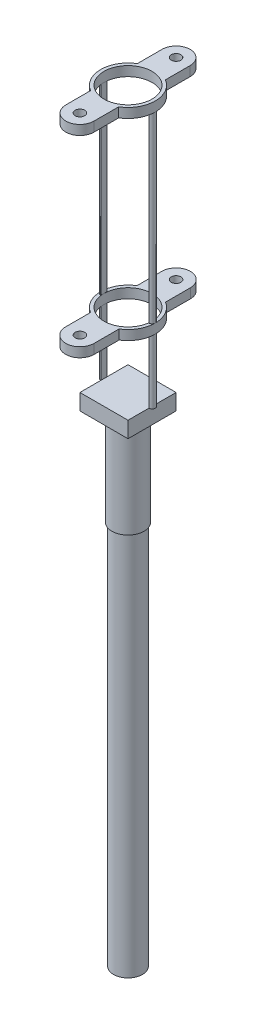
from build123d import *

# Parameters (mm, degrees)
SKETCH1_R             = 5
BOSS_EXTRUDE2_DEPTH   = 40
SKETCH2_R             = 5
SKETCH2_R_2           = 4.5
CUT_EXTRUDE1_DEPTH    = 10
SKETCH3_W             = 15
SKETCH3_H             = 15
BOSS_EXTRUDE3_DEPTH   = 5
BOSS_EXTRUDE4_DEPTH   = 80
BOSS_EXTRUDE4_2_DEPTH = 80
SKETCH5_R             = 8.5
SKETCH5_R_2           = 7.5
BOSS_EXTRUDE5_DEPTH   = 3
SKETCH6_R             = 1.5
BOSS_EXTRUDE6_DEPTH   = 3
BOSS_EXTRUDE7_START   = -110
SKETCH7_R             = 4.5
BOSS_EXTRUDE7_DEPTH   = 110
SKETCH8_R             = 7.5
BOSS_EXTRUDE8_DEPTH   = 3
SKETCH10_R            = 1.5
CUT_EXTRUDE2_DEPTH    = 3


with BuildPart() as part:
    # Sketch1 → Boss-Extrude2 (new body)
    with BuildSketch(Plane(origin=(0, 0, 0), x_dir=(1, 0, 0), z_dir=(0, 1, 0))):
        with Locations(Location((0, 0, 0), (0, 0, 270))):
            Circle(SKETCH1_R)
    extrude(amount=BOSS_EXTRUDE2_DEPTH)

    # Sketch2 → Cut-Extrude1 (cut)
    with BuildSketch(Plane(origin=(0, 0, 0), x_dir=(1, 0, 0), z_dir=(0, 1, 0))):
        with Locations(Location((0, 0, 0), (0, 0, 270))):
            Circle(SKETCH2_R)
        with Locations(Location((0, 0, 0), (0, 0, 270))):
            Circle(SKETCH2_R_2, mode=Mode.SUBTRACT)
    extrude(amount=CUT_EXTRUDE1_DEPTH, mode=Mode.SUBTRACT)

    # Sketch3 → Boss-Extrude3 (add)
    with BuildSketch(Plane(origin=(0, 40, 0), x_dir=(1, 0, 0), z_dir=(0, 1, 0))):
        Rectangle(SKETCH3_W, SKETCH3_H)
    extrude(amount=BOSS_EXTRUDE3_DEPTH)

    # Sketch7 → Boss-Extrude7 (add)
    with BuildSketch(Plane(origin=(0, 0, 0), x_dir=(1, 0, 0), z_dir=(0, 1, 0)).offset(BOSS_EXTRUDE7_START)):
        with Locations(Location((0, 0, 0), (0, 0, 270))):
            Circle(SKETCH7_R)
    extrude(amount=BOSS_EXTRUDE7_DEPTH)


with BuildPart() as body_2:
    # Sketch4 → Boss-Extrude4 (new body)
    with BuildSketch(Plane(origin=(0, 45, 0), x_dir=(1, 0, 0), z_dir=(0, 1, 0))):
        with BuildLine():
            Line((-7.5, -1), (-7.5, 1))
            ThreePointArc((-7.5, 1), (-8.5, 0), (-7.5, -1))
        make_face()
    extrude(amount=BOSS_EXTRUDE4_DEPTH)



with BuildPart() as body_3:
    # Sketch4 → Boss-Extrude4 2 (new body)
    with BuildSketch(Plane(origin=(0, 45, 0), x_dir=(1, 0, 0), z_dir=(0, 1, 0))):
        with BuildLine():
            ThreePointArc((8.5, 0), (8.207106781, 0.707106781), (7.5, 1))
            Line((7.5, 1), (7.5, -1))
            ThreePointArc((7.5, -1), (8.207106781, -0.707106781), (8.5, 0))
        make_face()
    extrude(amount=BOSS_EXTRUDE4_2_DEPTH)


with BuildPart() as body_2_1:
    add(body_2.part)

    add(body_3.part)  # Boss-Extrude5 merges body 3
    # Sketch5 → Boss-Extrude5 (add)
    with BuildSketch(Plane(origin=(0, 65, 0), x_dir=(1, 0, 0), z_dir=(0, 1, 0))):
        Circle(SKETCH5_R)
        Circle(SKETCH5_R_2, mode=Mode.SUBTRACT)
    extrude(amount=BOSS_EXTRUDE5_DEPTH)

    # Sketch6 → Boss-Extrude6 (add)
    # profile 1 of 2: a face of its own
    with BuildSketch(Plane(origin=(0, 65, 0), x_dir=(1, 0, 0), z_dir=(0, 1, 0))):
        with BuildLine():
            Line((-4.451682778, -7.241030344), (-4.451682778, -15.000257079))
            ThreePointArc((-4.451682778, -15.000257079), (0, -19.451939857), (4.451682778, -15.000257079))
            Line((4.451682778, -15.000257079), (4.451682778, -7.241030344))
            ThreePointArc((4.451682778, -7.241030344), (0, -8.5), (-4.451682778, -7.241030344))
        make_face()
        with Locations(Location((0, -15.000257079, 0), (0, 0, 270))):
            Circle(SKETCH6_R, mode=Mode.SUBTRACT)
    # profile 2 of 2: a face of its own
    with BuildSketch(Plane(origin=(0, 65, 0), x_dir=(1, 0, 0), z_dir=(0, 1, 0))):
        with BuildLine():
            Line((-4.451682778, 15.000257079), (-4.451682778, 7.241030344))
            ThreePointArc((-4.451682778, 7.241030344), (0, 8.5), (4.451682778, 7.241030344))
            Line((4.451682778, 7.241030344), (4.451682778, 15.000257079))
            ThreePointArc((4.451682778, 15.000257079), (0, 19.451939857), (-4.451682778, 15.000257079))
        make_face()
        with Locations(Location((0, 15.000257079, 0), (0, 0, 270))):
            Circle(SKETCH6_R, mode=Mode.SUBTRACT)
    extrude(amount=BOSS_EXTRUDE6_DEPTH)

    # Sketch8 → Boss-Extrude8 (add)
    with BuildSketch(Plane(origin=(0, 125, 0), x_dir=(1, 0, 0), z_dir=(0, 1, 0))):
        with BuildLine():
            ThreePointArc((4.381351245, -7.283801293), (8.5, 0), (4.381351245, 7.283801293))
            Line((4.381351245, 7.283801293), (4.381351245, 15.000257079))
            ThreePointArc((4.381351245, 15.000257079), (0, 19.381608324), (-4.381351245, 15.000257079))
            Line((-4.381351245, 15.000257079), (-4.381351245, 7.283801293))
            ThreePointArc((-4.381351245, 7.283801293), (-8.5, 0), (-4.381351245, -7.283801293))
            Line((-4.381351245, -7.283801293), (-4.381351245, -15.000257079))
            ThreePointArc((-4.381351245, -15.000257079), (0, -19.381608324), (4.381351245, -15.000257079))
            Line((4.381351245, -15.000257079), (4.381351245, -7.283801293))
        make_face()
        Circle(SKETCH8_R, mode=Mode.SUBTRACT)
    extrude(amount=BOSS_EXTRUDE8_DEPTH)

    # Sketch10 → Cut-Extrude2 (cut)
    with BuildSketch(Plane(origin=(0, 128, 0), x_dir=(1, 0, 0), z_dir=(0, 1, 0))):
        with Locations(Location((0, -15.000257079, 0), (0, 0, 270))):
            Circle(SKETCH10_R)
        with Locations(Location((0, 15.000257079, 0), (0, 0, 270))):
            Circle(SKETCH10_R)
    extrude(amount=-CUT_EXTRUDE2_DEPTH, mode=Mode.SUBTRACT)


solid = Compound([part.part, body_2_1.part])
